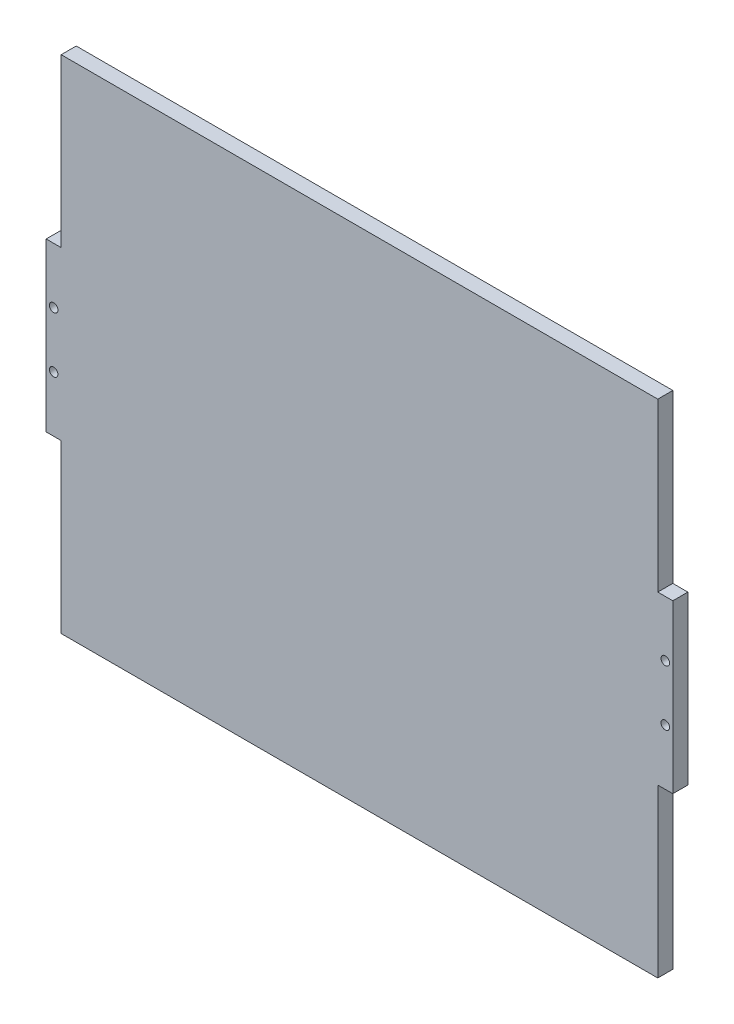
from build123d import *

# Parameters (mm, degrees)
SKETCH1_W            = 500
SKETCH1_H            = 400
BOSS_EXTRUDE1_DEPTH  = 12
SKETCH2_W            = 12
SKETCH2_H            = 133.333333333
CUT_EXTRUDE1_DEPTH   = 12
SCALE1_SCALE         = 0.5
M3_CLEARANCE_SLOT1_D = 3.4


with BuildPart() as part:
    # Sketch1 → Boss-Extrude1 (new body)
    with BuildSketch(Plane.XY):
        with Locations((250, 200)):
            Rectangle(SKETCH1_W, SKETCH1_H)
    extrude(amount=BOSS_EXTRUDE1_DEPTH)

    # Sketch2 → Cut-Extrude1 (cut)
    with BuildSketch(Plane.XY.offset(12)):
        with Locations((494, 333.333333334)):
            Rectangle(SKETCH2_W, SKETCH2_H)
        with Locations((6, 333.333333334)):
            Rectangle(SKETCH2_W, SKETCH2_H)
        with Locations((6, 66.666666667)):
            Rectangle(SKETCH2_W, SKETCH2_H)
        with Locations((494, 66.666666667)):
            Rectangle(SKETCH2_W, SKETCH2_H)
    extrude(amount=-CUT_EXTRUDE1_DEPTH, mode=Mode.SUBTRACT)


with BuildPart() as part_1:
    # Scale1: scaled about (250, 200, 6)
    add(part.part.scale(SCALE1_SCALE).moved(Location((125, 100, 3))))

    # M3 Clearance Slot1 (through all)
    with Locations(Plane(origin=(0, 0, 3), x_dir=(-1, 0, 0), z_dir=(0, 0, -1))):
        with Locations((-372, 211.113333333), (-372, 188.886666667), (-128, 211.11), (-128, 188.89)):
            Hole(M3_CLEARANCE_SLOT1_D / 2)


solid = part_1.part
